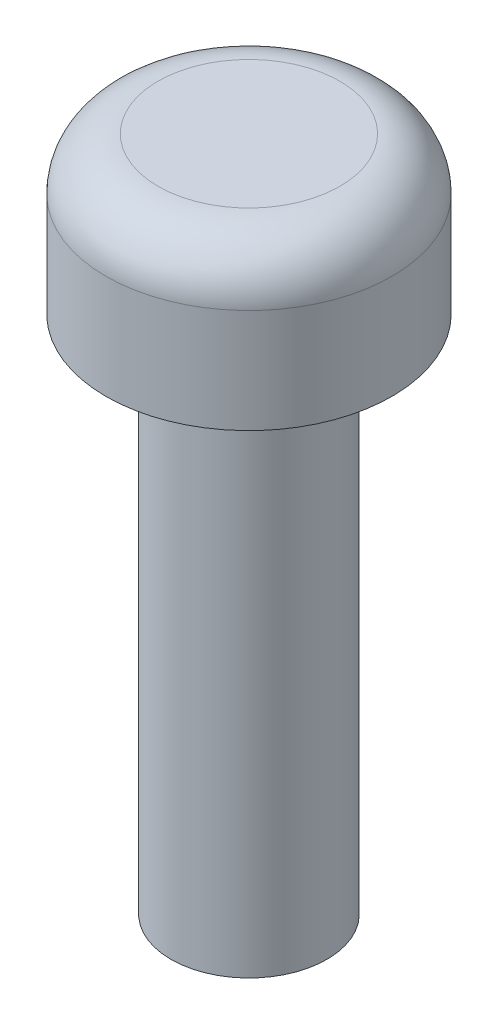
from build123d import *

# Parameters (mm, degrees)
SKETCH1_R           = 1.5
BOSS_EXTRUDE1_DEPTH = 10
SKETCH2_R           = 2.75
BOSS_EXTRUDE2_DEPTH = 3
FILLET1_R           = 1


with BuildPart() as part:
    # Sketch1 → Boss-Extrude1 (new body)
    with BuildSketch(Plane(origin=(0, 0, 0), x_dir=(1, 0, 0), z_dir=(0, 1, 0))):
        with Locations(Location((0, 0, 0), (0, 0, 270))):
            Circle(SKETCH1_R)
    extrude(amount=BOSS_EXTRUDE1_DEPTH)

    # Sketch2 → Boss-Extrude2 (add)
    with BuildSketch(Plane(origin=(0, 10, 0), x_dir=(1, 0, 0), z_dir=(0, 1, 0))):
        with Locations(Location((0, 0, 0), (0, 0, 270))):
            Circle(SKETCH2_R)
    extrude(amount=BOSS_EXTRUDE2_DEPTH)

    # Fillet1
    fillet1_edges = [part.edges().sort_by_distance(p)[0] for p in [
        (0, 13, -2.75),
    ]]
    fillet(fillet1_edges, radius=FILLET1_R)


solid = part.part
